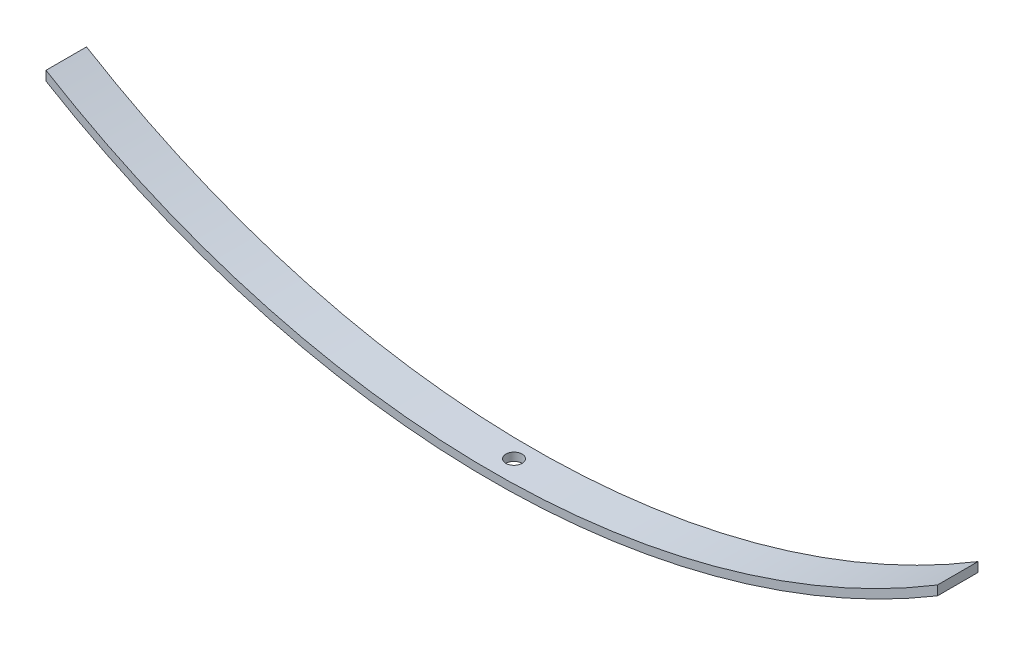
from build123d import *

# Parameters (mm, degrees)
BOSS_EXTRUDE1_DEPTH = 50
SKETCH3_R           = 10
CUT_EXTRUDE1_DEPTH  = 1205.117934423


with BuildPart() as part:
    # Sketch1 → Boss-Extrude1 (new body)
    with BuildSketch(Plane.XY):
        with BuildLine():
            Line((-550, -906.145683651), (-550, -917.823512447))
            ThreePointArc((-550, -917.823512447), (0, -1070), (550, -917.823512447))
            Line((550, -917.823512447), (550, -906.145683651))
            ThreePointArc((550, -906.145683651), (0, -1060), (-550, -906.145683651))
        make_face()
    extrude(amount=BOSS_EXTRUDE1_DEPTH)

    # Sketch3 → Cut-Extrude1 (cut, through all)
    with BuildSketch(Plane(origin=(0, 0, 0), x_dir=(1, 0, 0), z_dir=(0, 1, 0))):
        with Locations(Location((0, -22.5, 0), (0, 0, 270))):
            Circle(SKETCH3_R)
    extrude(amount=-CUT_EXTRUDE1_DEPTH, mode=Mode.SUBTRACT)


solid = part.part
